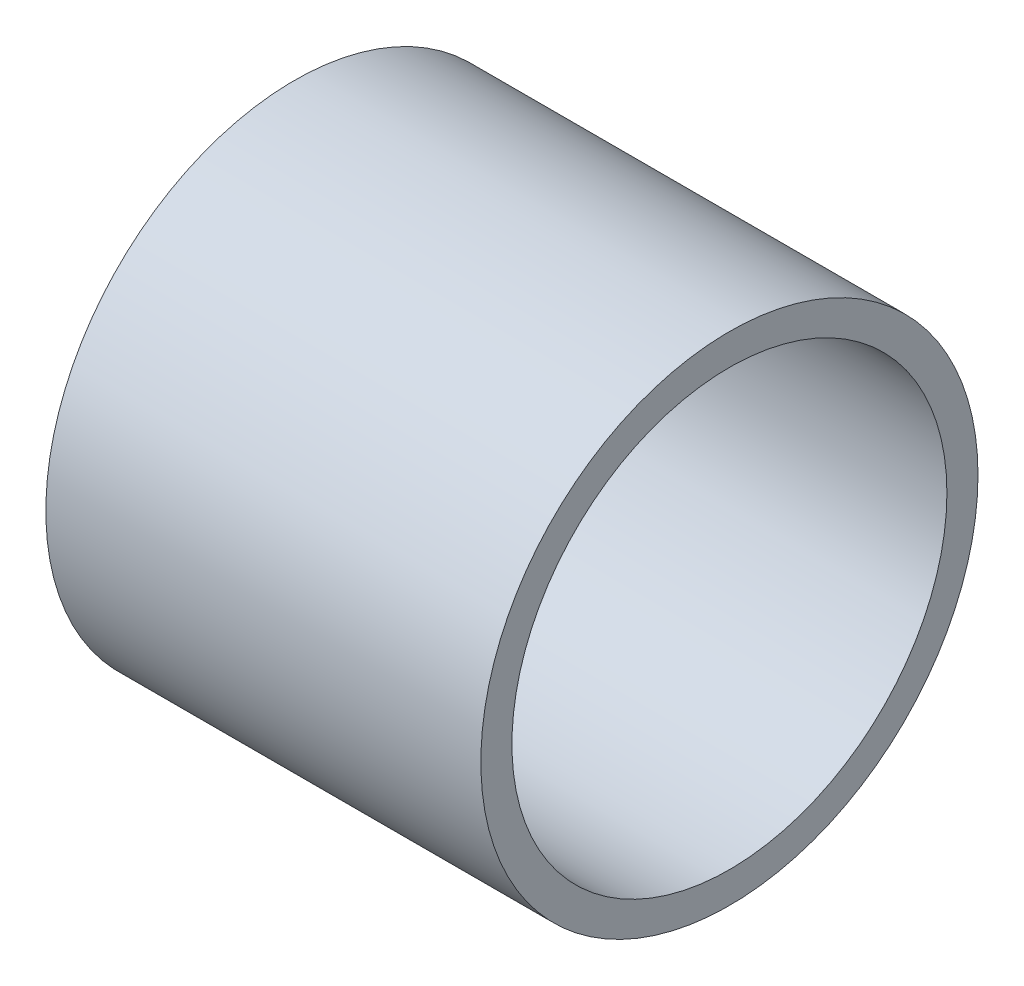
from build123d import *

# Parameters (mm, degrees)
CROQUIS1_R              = 16
CROQUIS1_R_2            = 14
SALIENTE_EXTRUIR1_DEPTH = 28
CROQUIS2_R              = 14
CROQUIS2_R_2            = 9
SALIENTE_EXTRUIR2_DEPTH = 2


with BuildPart() as part:
    # Croquis1 → Saliente-Extruir1 (new body)
    with BuildSketch(Plane(origin=(0, 0, 0), x_dir=(0, 0, -1), z_dir=(1, 0, 0))):
        Circle(CROQUIS1_R)
        Circle(CROQUIS1_R_2, mode=Mode.SUBTRACT)
    extrude(amount=SALIENTE_EXTRUIR1_DEPTH)

    # Croquis2 → Saliente-Extruir2 (add)
    with BuildSketch(Plane(origin=(0, 0, 0), x_dir=(0, 0, -1), z_dir=(1, 0, 0))):
        Circle(CROQUIS2_R)
        Circle(CROQUIS2_R_2, mode=Mode.SUBTRACT)
    extrude(amount=SALIENTE_EXTRUIR2_DEPTH)


solid = part.part
